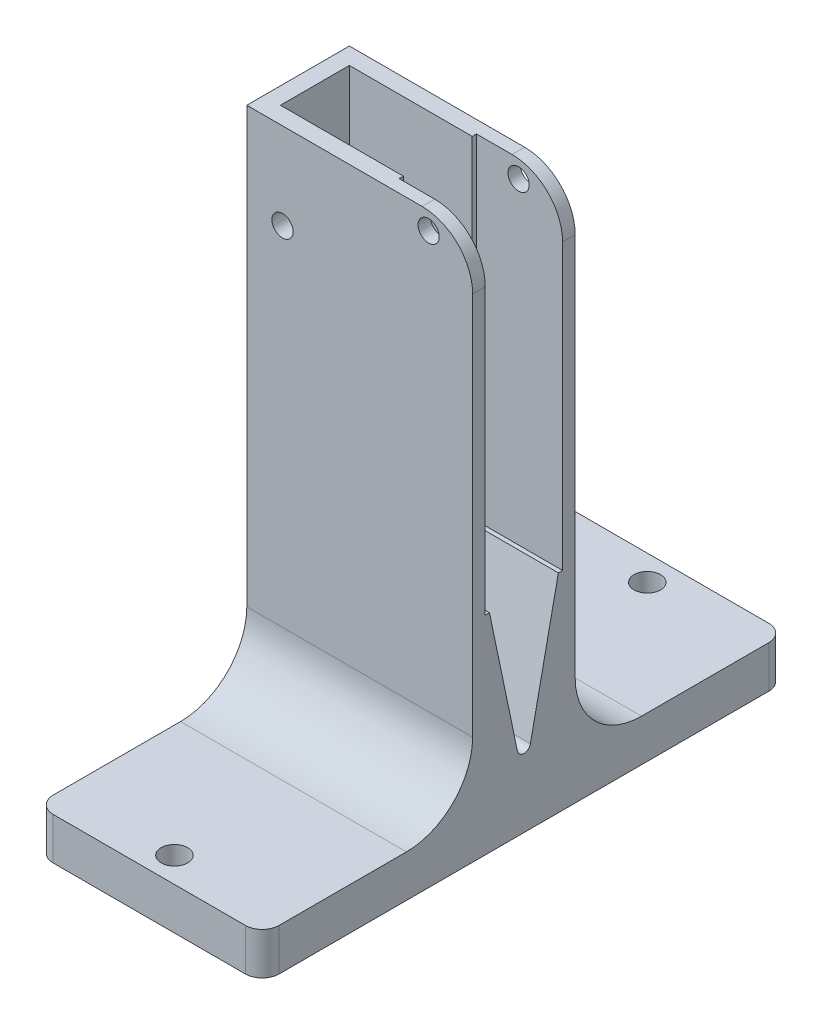
from build123d import *

# Parameters (mm, degrees)
SKETCH1_R                 = 1.999996
BOSS_EXTRUDE1_DEPTH       = 6.35
BOSS_EXTRUDE1_2_DEPTH     = 6.35
SKETCH1_3_W               = 34.08
SKETCH1_3_H               = 15.48
BOSS_EXTRUDE2_DEPTH       = 62.5
SKETCH2_W                 = 34.08
SKETCH2_H                 = 15.48
SKETCH2_W_2               = 29
SKETCH2_H_2               = 10.4
BOSS_EXTRUDE3_DEPTH       = 19.4
SKETCH3_W                 = 11.67
SKETCH3_H                 = 21.9
CUT_EXTRUDE1_DEPTH        = 13
SKETCH4_W                 = 5
SKETCH4_H                 = 10.4
BOSS_EXTRUDE4_DEPTH       = 3.2
CUT_EXTRUDE3_DEPTH        = 97.065834197
CUT_EXTRUDE3_DEPTH_BACK   = 97.065834197
F_3_0MM_DOWEL_HOLE1_D     = 3.2
F_3_0MM_DOWEL_HOLE1_DEPTH = 15.48
F_3_0MM_DOWEL_HOLE1_TIP   = 0.96137699
SKETCH10_W                = 13.54
SKETCH10_H                = 10.4
CUT_EXTRUDE5_DEPTH        = 2.5
FILLET1_R                 = 10
CUT_EXTRUDE6_DEPTH        = 53.65
BOSS_EXTRUDE5_DEPTH       = 26.54
FILLET3_R                 = 1


with BuildPart() as part:
    # Sketch1 → Boss-Extrude1 (new body)
    with BuildSketch(Plane(origin=(0, 0, 0), x_dir=(1, 0, 0), z_dir=(0, 1, 0))):
        with BuildLine():
            ThreePointArc((-17.04, 36.95), (-16.296051224, 38.746051224), (-14.5, 39.49))
            Line((-14.5, 39.49), (14.5, 39.49))
            ThreePointArc((14.5, 39.49), (16.296051224, 38.746051224), (17.04, 36.95))
            Line((17.04, 36.95), (17.04, 7.74))
            Line((17.04, 7.74), (-17.04, 7.74))
            Line((-17.04, 7.74), (-17.04, 36.95))
        make_face()
        with Locations(Location((-0.022, 35.68, 0), (0, 0, 270))):
            Circle(SKETCH1_R, mode=Mode.SUBTRACT)
    extrude(amount=BOSS_EXTRUDE1_DEPTH)



with BuildPart() as body_2:
    # Sketch1 → Boss-Extrude1 2 (new body)
    with BuildSketch(Plane(origin=(0, 0, 0), x_dir=(1, 0, 0), z_dir=(0, 1, 0))):
        with BuildLine():
            Line((-17.04, -7.74), (-17.04, -36.95))
            ThreePointArc((-17.04, -36.95), (-16.296051224, -38.746051224), (-14.5, -39.49))
            Line((-14.5, -39.49), (14.5, -39.49))
            ThreePointArc((14.5, -39.49), (16.296051224, -38.746051224), (17.04, -36.95))
            Line((17.04, -36.95), (17.04, -7.74))
            Line((17.04, -7.74), (-17.04, -7.74))
        make_face()
        with Locations(Location((-0.022, -35.68, 0), (0, 0, 270))):
            Circle(SKETCH1_R, mode=Mode.SUBTRACT)
    extrude(amount=BOSS_EXTRUDE1_2_DEPTH)


with BuildPart() as part_1:
    add(part.part)

    add(body_2.part)  # Boss-Extrude2 merges body 2
    # Sketch1<3> → Boss-Extrude2 (add)
    with BuildSketch(Plane(origin=(0, 0, 0), x_dir=(1, 0, 0), z_dir=(0, 1, 0))):
        Rectangle(SKETCH1_3_W, SKETCH1_3_H)
    extrude(amount=BOSS_EXTRUDE2_DEPTH)

    # Sketch2 → Boss-Extrude3 (add)
    with BuildSketch(Plane(origin=(0, 62.5, 0), x_dir=(1, 0, 0), z_dir=(0, 1, 0))):
        Rectangle(SKETCH2_W, SKETCH2_H)
        Rectangle(SKETCH2_W_2, SKETCH2_H_2, mode=Mode.SUBTRACT)
    extrude(amount=BOSS_EXTRUDE3_DEPTH)

    # Sketch3 → Cut-Extrude1 (cut)
    with BuildSketch(Plane(origin=(17.04, 0, 0), x_dir=(0, 0, -1), z_dir=(1, 0, 0))):
        with Locations((0, 70.95)):
            Rectangle(SKETCH3_W, SKETCH3_H)
    extrude(amount=-CUT_EXTRUDE1_DEPTH, mode=Mode.SUBTRACT)

    # Sketch4 → Boss-Extrude4 (add)
    with BuildSketch(Plane(origin=(0, 62.5, 0), x_dir=(1, 0, 0), z_dir=(0, 1, 0))):
        with Locations((-12, 0)):
            Rectangle(SKETCH4_W, SKETCH4_H)
    extrude(amount=BOSS_EXTRUDE4_DEPTH)

    # Sketch5 → Cut-Extrude3 (cut, two sides: drawn at the far end of the back side and taken through both)
    with BuildSketch(Plane(origin=(0, 0, -7.74), x_dir=(-1, 0, 0), z_dir=(0, 0, -1)).offset(-CUT_EXTRUDE3_DEPTH_BACK)):
        with BuildLine():
            Line((-17.04, 81.9), (-17.04, 74.28))
            ThreePointArc((-17.04, 74.28), (-14.808153673, 79.668153673), (-9.42, 81.9))
            Line((-9.42, 81.9), (-17.04, 81.9))
        make_face()
    extrude(amount=CUT_EXTRUDE3_DEPTH + CUT_EXTRUDE3_DEPTH_BACK, mode=Mode.SUBTRACT)

    # Ø3.0mm Dowel Hole1
    with Locations(Plane(origin=(0, 0, -7.74), x_dir=(-1, 0, 0), z_dir=(0, 0, -1))):
        with Locations((11.650000349, 68.85), (-10.400000349, 79.2)):
            Hole(F_3_0MM_DOWEL_HOLE1_D / 2, depth=F_3_0MM_DOWEL_HOLE1_DEPTH)
            with Locations((0, 0, -(F_3_0MM_DOWEL_HOLE1_DEPTH + F_3_0MM_DOWEL_HOLE1_TIP / 2))):  # 118° drill point
                Cone(0, F_3_0MM_DOWEL_HOLE1_D / 2, F_3_0MM_DOWEL_HOLE1_TIP, mode=Mode.SUBTRACT)

    # Sketch10 → Cut-Extrude5 (cut)
    with BuildSketch(Plane(origin=(0, 62.5, 0), x_dir=(1, 0, 0), z_dir=(0, 1, 0))):
        with Locations((-2.73, 0)):
            Rectangle(SKETCH10_W, SKETCH10_H)
    extrude(amount=-CUT_EXTRUDE5_DEPTH, mode=Mode.SUBTRACT)

    # Fillet1
    fillet1_edges = [part_1.edges().sort_by_distance(p)[0] for p in [
        (0, 6.35, -7.74),
        (0, 6.35, 7.74),
    ]]
    fillet(fillet1_edges, radius=FILLET1_R)

    # Sketch11 → Cut-Extrude6 (cut)
    with BuildSketch(Plane(origin=(0, 60, 0), x_dir=(1, 0, 0), z_dir=(0, 1, 0))):
        Polygon((17.04, -5.835), (17.04, 5.835), (4.04, 5.835), (4.04, 5.2), (-9.5, 5.2), (-9.5, -5.2), (4.04, -5.2), (4.04, -5.835), align=None)
    extrude(amount=-CUT_EXTRUDE6_DEPTH, mode=Mode.SUBTRACT)

    # Sketch12 → Boss-Extrude5 (add)
    with BuildSketch(Plane(origin=(-9.5, 0, 0), x_dir=(0, 0, -1), z_dir=(1, 0, 0))):
        Polygon((-5.2, 31.35), (-5.835, 31.35), (-5.835, 6.35), (0, 6.35), (5.835, 6.35), (5.835, 31.35), (5.2, 31.35), (0, 6.45), align=None)
    extrude(amount=BOSS_EXTRUDE5_DEPTH)

    # Fillet3
    fillet3_edges = [part_1.edges().sort_by_distance(p)[0] for p in [
        (3.77, 6.45, 0),
    ]]
    fillet(fillet3_edges, radius=FILLET3_R)


solid = part_1.part
